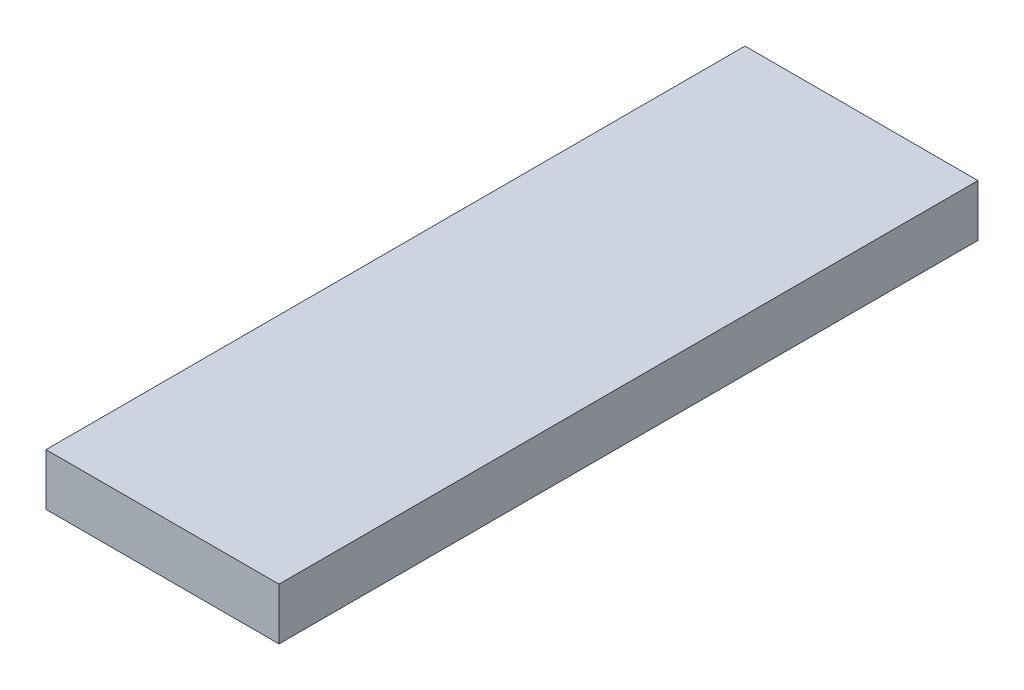
from build123d import *

# Parameters (mm, degrees)
SKETCH1_W           = 9
SKETCH1_H           = 27
BOSS_EXTRUDE1_DEPTH = 2


with BuildPart() as part:
    # Sketch1 → Boss-Extrude1 (new body)
    with BuildSketch(Plane(origin=(0, 0, 0), x_dir=(1, 0, 0), z_dir=(0, 1, 0))):
        Rectangle(SKETCH1_W, SKETCH1_H)
    extrude(amount=BOSS_EXTRUDE1_DEPTH)


solid = part.part
